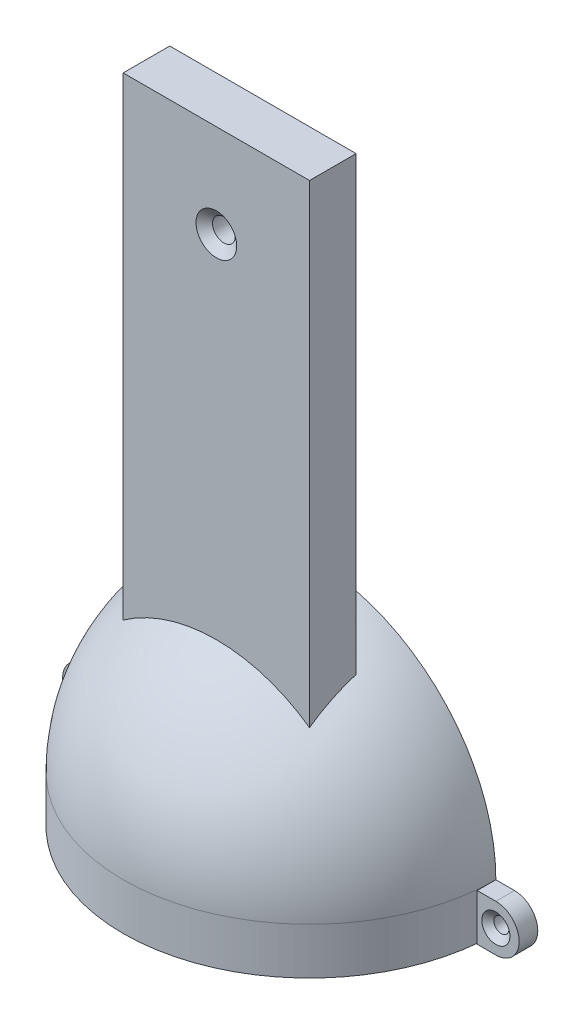
from build123d import *

# Parameters (mm, degrees)
REVOLVE2_ANGLE                            = 90
BOSS_EXTRUDE2_DEPTH                       = 5
BOSS_EXTRUDE3_DEPTH                       = 2
BOSS_EXTRUDE3_2_DEPTH                     = 2
CSK_FOR_0_FLAT_HEAD_MACHINE_SCREW_2_COUNT = 2
CSK_FOR_0_FLAT_HEAD_MACHINE_SCREW_2_PITCH = 44
BOSS_EXTRUDE4_START                       = 14.142136
SKETCH10_W                                = 20
SKETCH10_H                                = 5
BOSS_EXTRUDE4_DEPTH                       = 50.857864
SKETCH11_R                                = 5
BOSS_EXTRUDE6_DEPTH                       = 5


with BuildPart() as part:
    # Sketch1 → Revolve2 (revolve)
    with BuildSketch(Plane.XY):
        with BuildLine():
            Line((-20, 0), (-15, 0))
            ThreePointArc((-15, 0), (0, 15), (15, 0))
            Line((15, 0), (20, 0))
            ThreePointArc((20, 0), (0, 20), (-20, 0))
        make_face()
    revolve(axis=Axis((10, 0, 0), (1, 0, 0)), revolution_arc=REVOLVE2_ANGLE)

    # Sketch3 → Boss-Extrude2 (add)
    with BuildSketch(Plane.XZ):
        with BuildLine():
            Line((-20, 0), (-10, 0))
            ThreePointArc((-10, 0), (0, 10), (10, 0))
            Line((10, 0), (20, 0))
            ThreePointArc((20, 0), (0, 20), (-20, 0))
        make_face()
    extrude(amount=BOSS_EXTRUDE2_DEPTH)

    # Sketch10 → Boss-Extrude4 (add)
    with BuildSketch(Plane(origin=(0, 0, 0), x_dir=(1, 0, 0), z_dir=(0, 1, 0)).offset(BOSS_EXTRUDE4_START)):
        with Locations((0, -7.5)):
            Rectangle(SKETCH10_W, SKETCH10_H)
    extrude(amount=BOSS_EXTRUDE4_DEPTH)

    # Sketch11 → Boss-Extrude6 (add)
    with BuildSketch(Plane(origin=(0, 0, 5), x_dir=(-1, 0, 0), z_dir=(0, 0, -1))):
        with Locations(Location((0, 55, 0), (0, 0, 180))):
            Circle(SKETCH11_R)
    extrude(amount=BOSS_EXTRUDE6_DEPTH)

    # Sketch15 → CSK for #2 Flat Head Machine Screw (100)1 (revolve, cut)
    with BuildSketch(Plane(origin=(0, 55, 10), x_dir=(0, -1, 0), z_dir=(1, 0, 0))):
        Polygon((0, 0), (0, 10), (1.2192, 10), (1.2192, 0.809898964), (2.1844, 0), align=None)
    revolve(axis=Axis((0, 55, 16.35), (0, 0, -1)), mode=Mode.SUBTRACT)


with BuildPart() as body_2:
    # Sketch5 → Boss-Extrude3 (new body)
    with BuildSketch(Plane(origin=(0, 0, 0), x_dir=(-1, 0, 0), z_dir=(0, 0, -1))):
        with BuildLine():
            Line((-22, 0), (-20, 0))
            Line((-20, 0), (-20, -5))
            Line((-20, -5), (-22, -5))
            ThreePointArc((-22, -5), (-24.5, -2.5), (-22, 0))
        make_face()
    extrude(amount=-BOSS_EXTRUDE3_DEPTH)

    # Sketch9 → CSK for #0 Flat Head Machine Screw (100)3 (revolve, cut)
    with BuildSketch(Plane(origin=(22, -2.5, 2), x_dir=(0, -1, 0), z_dir=(1, 0, 0))):
        Polygon((0, 0), (0, 2), (0.80645, 2), (0.80645, 0.591439375), (1.5113, 0), align=None)
    csk_for_0_flat_head_machine_screw_100 = revolve(axis=Axis((22, -2.5, 8.35), (0, 0, -1)), mode=Mode.SUBTRACT)


with BuildPart() as body_3:
    # Sketch5 → Boss-Extrude3 2 (new body)
    with BuildSketch(Plane(origin=(0, 0, 0), x_dir=(-1, 0, 0), z_dir=(0, 0, -1))):
        with BuildLine():
            Line((22, -5), (20, -5))
            Line((20, -5), (20, 0))
            Line((20, 0), (22, 0))
            ThreePointArc((22, 0), (24.5, -2.5), (22, -5))
        make_face()
    extrude(amount=-BOSS_EXTRUDE3_2_DEPTH)

    # CSK for _0 Flat Head Machine Screw _ 2: CSK for #0 Flat Head Machine Screw (100)3 ×2
    with Locations(*[(-i * CSK_FOR_0_FLAT_HEAD_MACHINE_SCREW_2_PITCH, 0, 0) for i in range(1, CSK_FOR_0_FLAT_HEAD_MACHINE_SCREW_2_COUNT)]):
        add(csk_for_0_flat_head_machine_screw_100, mode=Mode.SUBTRACT)


solid = Compound([part.part, body_2.part, body_3.part])
